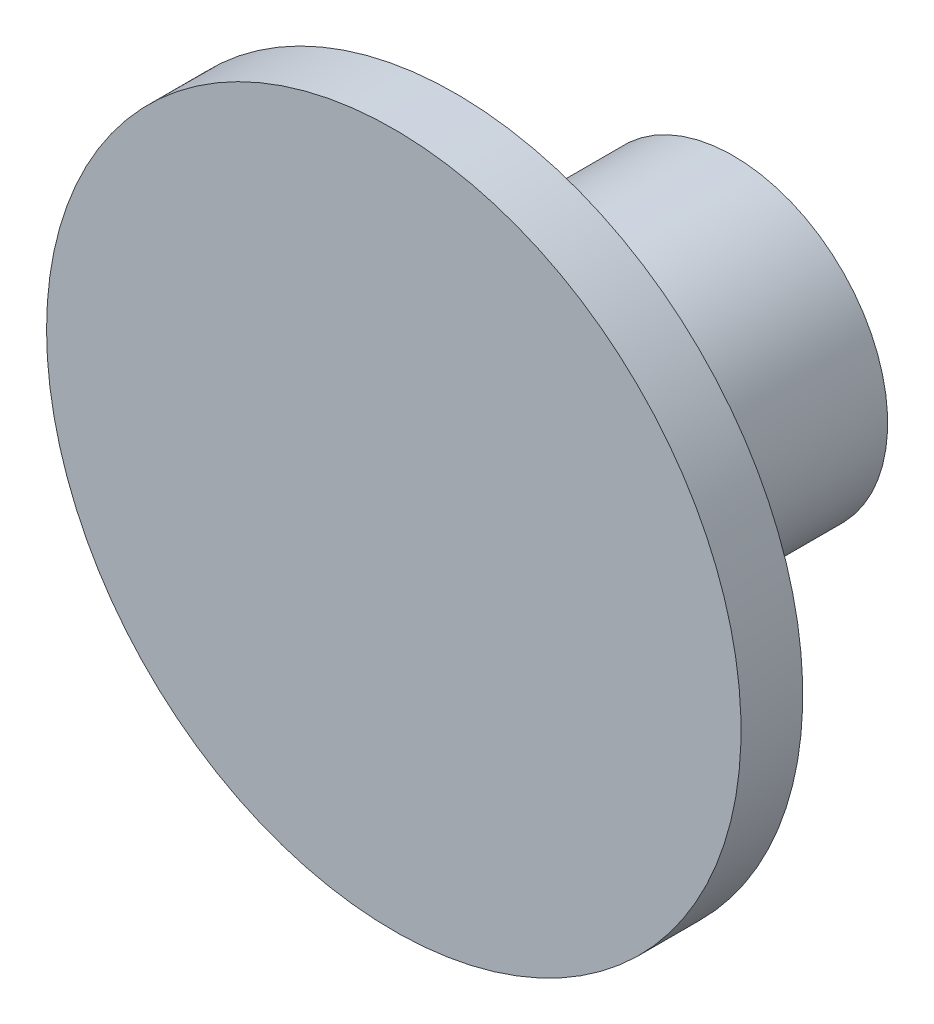
from build123d import *


with BuildPart() as part:
    # Sketch1 → Revolve1 (revolve)
    with BuildSketch(Plane.XZ.offset(10.052593298), mode=Mode.PRIVATE) as revolve1_sk:
        Polygon((4.5, -31.5), (0, -31.5), (0, -35.9), (2, -35.9), (2, -32.3), (4.5, -32.3), align=None)
    revolve(revolve1_sk.sketch.rotate(Axis((0, -10.052593298, -31.5), (0, 0, -1)), 180), axis=Axis((0, -10.052593298, -31.5), (0, 0, -1)))


solid = part.part
